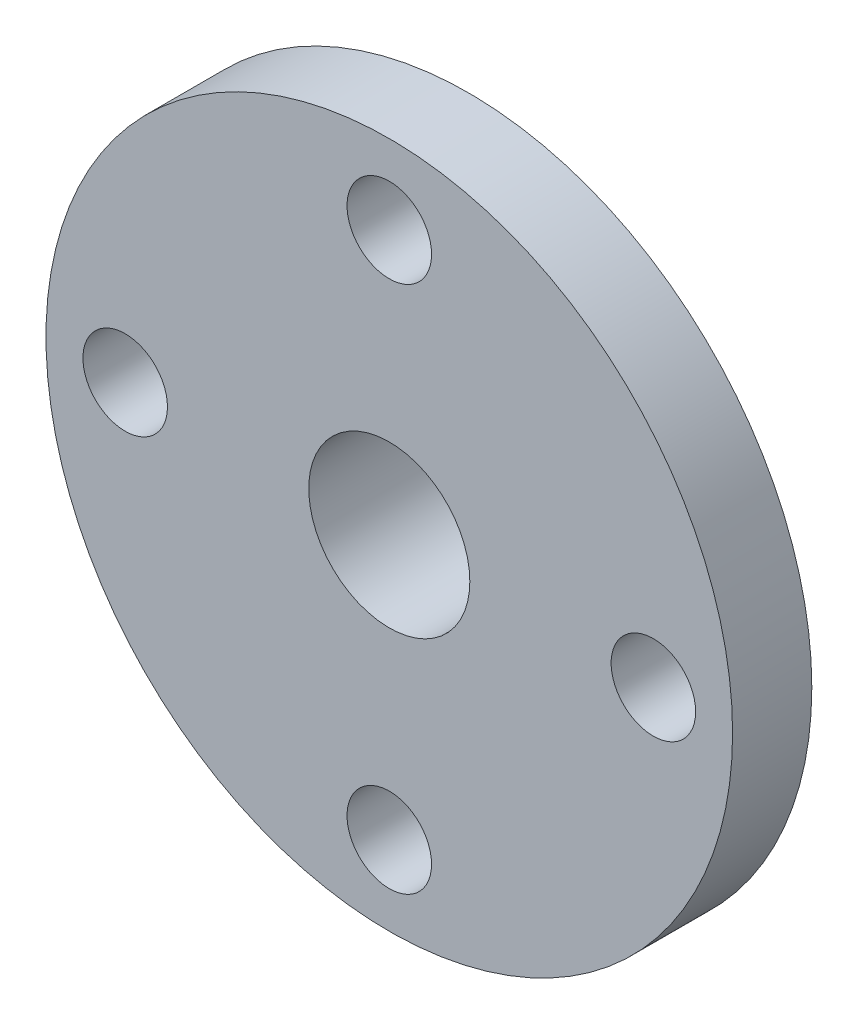
from build123d import *

# Parameters (mm, degrees)
HORN_PLATE_ENVELOPE_PROFILE_R           = 13
HORN_PLATE_ENVELOPE_PROFILE_R_2         = 3.05
HORN_PLATE_ENVELOPE_DEPTH               = 3
SPLINE_HUB_ENVELOPE_START               = -4
SPLINE_HUB_ENVELOPE_PROFILE_R           = 4.5
SPLINE_HUB_ENVELOPE_PROFILE_R_2         = 3.05
SPLINE_HUB_ENVELOPE_DEPTH               = 4
NOMINAL_HORN_ATTACHMENT_HOLES_START     = -50
NOMINAL_HORN_ATTACHMENT_HOLES_PROFILE_R = 1.6
NOMINAL_HORN_ATTACHMENT_HOLES_DEPTH     = 69.814887722


with BuildPart() as part:
    # Horn_plate_envelope_profile → Horn_plate_envelope (new body)
    with BuildSketch(Plane.XY):
        Circle(HORN_PLATE_ENVELOPE_PROFILE_R)
        Circle(HORN_PLATE_ENVELOPE_PROFILE_R_2, mode=Mode.SUBTRACT)
    extrude(amount=HORN_PLATE_ENVELOPE_DEPTH)

    # Spline_hub_envelope_profile → Spline_hub_envelope (add)
    with BuildSketch(Plane.XY.offset(SPLINE_HUB_ENVELOPE_START)):
        Circle(SPLINE_HUB_ENVELOPE_PROFILE_R)
        Circle(SPLINE_HUB_ENVELOPE_PROFILE_R_2, mode=Mode.SUBTRACT)
    extrude(amount=SPLINE_HUB_ENVELOPE_DEPTH)

    # Nominal_horn_attachment_holes_profile → Nominal_horn_attachment_holes (cut, through all)
    with BuildSketch(Plane.XY.offset(NOMINAL_HORN_ATTACHMENT_HOLES_START)):
        with Locations((-10, 0)):
            Circle(NOMINAL_HORN_ATTACHMENT_HOLES_PROFILE_R)
        with Locations((10, 0)):
            Circle(NOMINAL_HORN_ATTACHMENT_HOLES_PROFILE_R)
        with Locations((0, -10)):
            Circle(NOMINAL_HORN_ATTACHMENT_HOLES_PROFILE_R)
        with Locations((0, 10)):
            Circle(NOMINAL_HORN_ATTACHMENT_HOLES_PROFILE_R)
    extrude(amount=NOMINAL_HORN_ATTACHMENT_HOLES_DEPTH, mode=Mode.SUBTRACT)


solid = part.part
